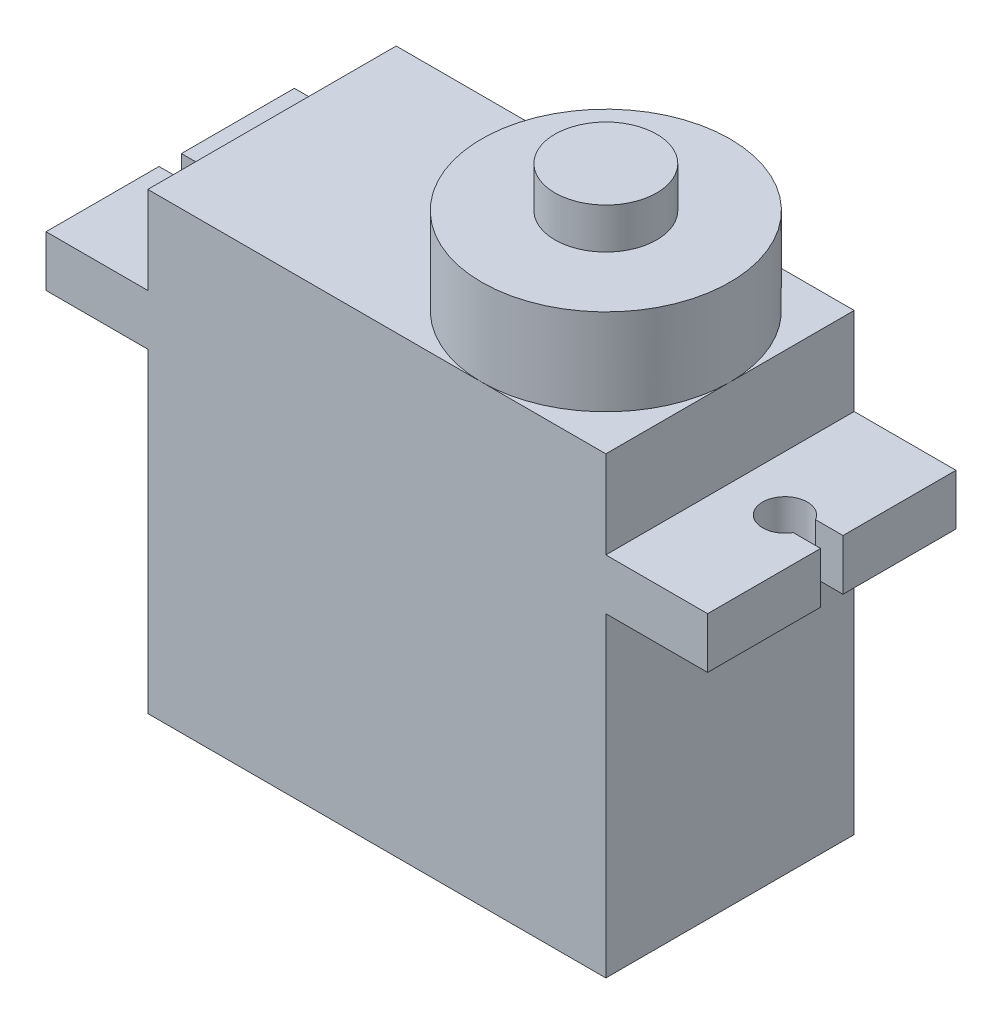
from build123d import *

# Parameters (mm, degrees)
SKETCH1_W           = 22.5
SKETCH1_H           = 12.2
BOSS_EXTRUDE1_DEPTH = 22.3
SKETCH2_W           = 12.2
SKETCH2_H           = 2.5
BOSS_EXTRUDE2_DEPTH = 5
CUT_EXTRUDE1_DEPTH  = 28.554396191
SKETCH5_R           = 6.1
BOSS_EXTRUDE3_DEPTH = 4.25
SKETCH6_R           = 2.5
BOSS_EXTRUDE4_DEPTH = 2


with BuildPart() as part:
    # Sketch1 → Boss-Extrude1 (new body)
    with BuildSketch(Plane(origin=(0, 0, 0), x_dir=(1, 0, 0), z_dir=(0, 1, 0))):
        with Locations((3.369036145, -0.994939759)):
            Rectangle(SKETCH1_W, SKETCH1_H)
    extrude(amount=BOSS_EXTRUDE1_DEPTH)

    # Sketch2 → Boss-Extrude2 (add)
    with BuildSketch(Plane(origin=(14.619036145, 0, 0), x_dir=(0, 0, -1), z_dir=(1, 0, 0))):
        with Locations((-0.994939759, 16.75)):
            Rectangle(SKETCH2_W, SKETCH2_H)
    boss_extrude2 = extrude(amount=BOSS_EXTRUDE2_DEPTH)

    # Sketch3 → Cut-Extrude1 (cut, through all)
    with BuildSketch(Plane(origin=(0, 18, 0), x_dir=(1, 0, 0), z_dir=(0, 1, 0))):
        with BuildLine():
            Line((18.271664089, -0.444939759), (19.619036145, -0.444939759))
            Line((19.619036145, -0.444939759), (19.619036145, -1.544939759))
            Line((19.619036145, -1.544939759), (18.271664089, -1.544939759))
            ThreePointArc((18.271664089, -1.544939759), (16.219036145, -0.994939759), (18.271664089, -0.444939759))
        make_face()
    cut_extrude1 = extrude(amount=-CUT_EXTRUDE1_DEPTH, mode=Mode.SUBTRACT)

    # Mirror1: Boss-Extrude2, Cut-Extrude1 across plane
    add(boss_extrude2.mirror(Plane(origin=(3.369036145, 0, 0), x_dir=(0, 0, 1), z_dir=(1, 0, 0))))
    add(cut_extrude1.mirror(Plane(origin=(3.369036145, 0, 0), x_dir=(0, 0, 1), z_dir=(1, 0, 0))), mode=Mode.SUBTRACT)

    # Sketch5 → Boss-Extrude3 (add)
    with BuildSketch(Plane(origin=(0, 22.3, 0), x_dir=(1, 0, 0), z_dir=(0, 1, 0))):
        with Locations(Location((8.519036145, -0.994939759, 0), (0, 0, 270))):
            Circle(SKETCH5_R)
    extrude(amount=BOSS_EXTRUDE3_DEPTH)

    # Sketch6 → Boss-Extrude4 (add)
    with BuildSketch(Plane(origin=(0, 26.55, 0), x_dir=(1, 0, 0), z_dir=(0, 1, 0))):
        with Locations(Location((8.519036145, -0.994939759, 0), (0, 0, 270))):
            Circle(SKETCH6_R)
    extrude(amount=BOSS_EXTRUDE4_DEPTH)


solid = part.part
